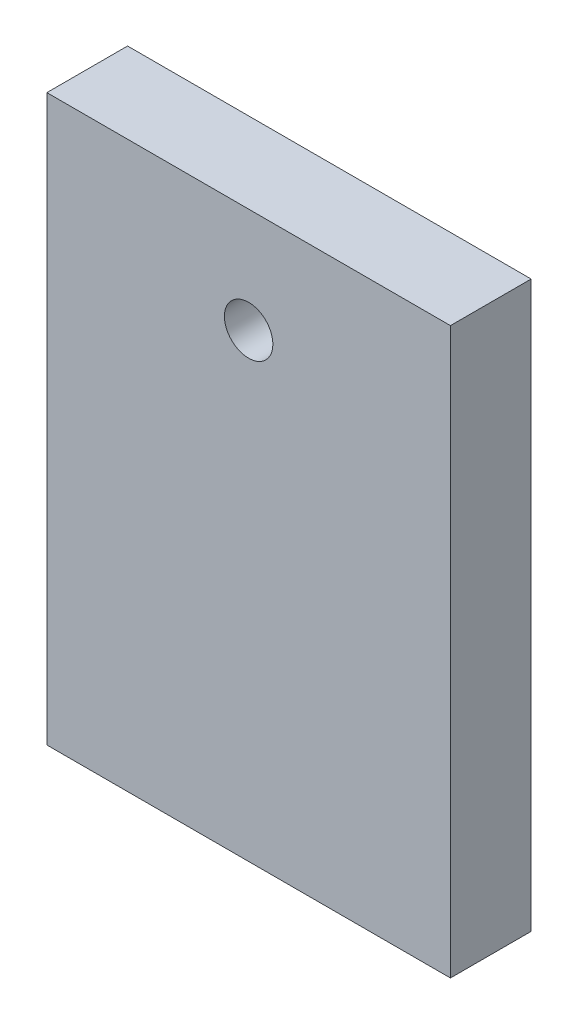
from build123d import *

# Parameters (mm, degrees)
SKETCH2_W           = 25
SKETCH2_H           = 35
BOSS_EXTRUDE1_DEPTH = 5
SKETCH3_R           = 1.5
CUT_EXTRUDE1_DEPTH  = 23.079402166


with BuildPart() as part:
    # Sketch2 → Boss-Extrude1 (new body)
    with BuildSketch(Plane.XY):
        Rectangle(SKETCH2_W, SKETCH2_H)
    extrude(amount=BOSS_EXTRUDE1_DEPTH)

    # Sketch3 → Cut-Extrude1 (cut, through all)
    with BuildSketch(Plane.XY.offset(5)):
        with Locations((0, 11)):
            Circle(SKETCH3_R)
    extrude(amount=-CUT_EXTRUDE1_DEPTH, mode=Mode.SUBTRACT)


solid = part.part
